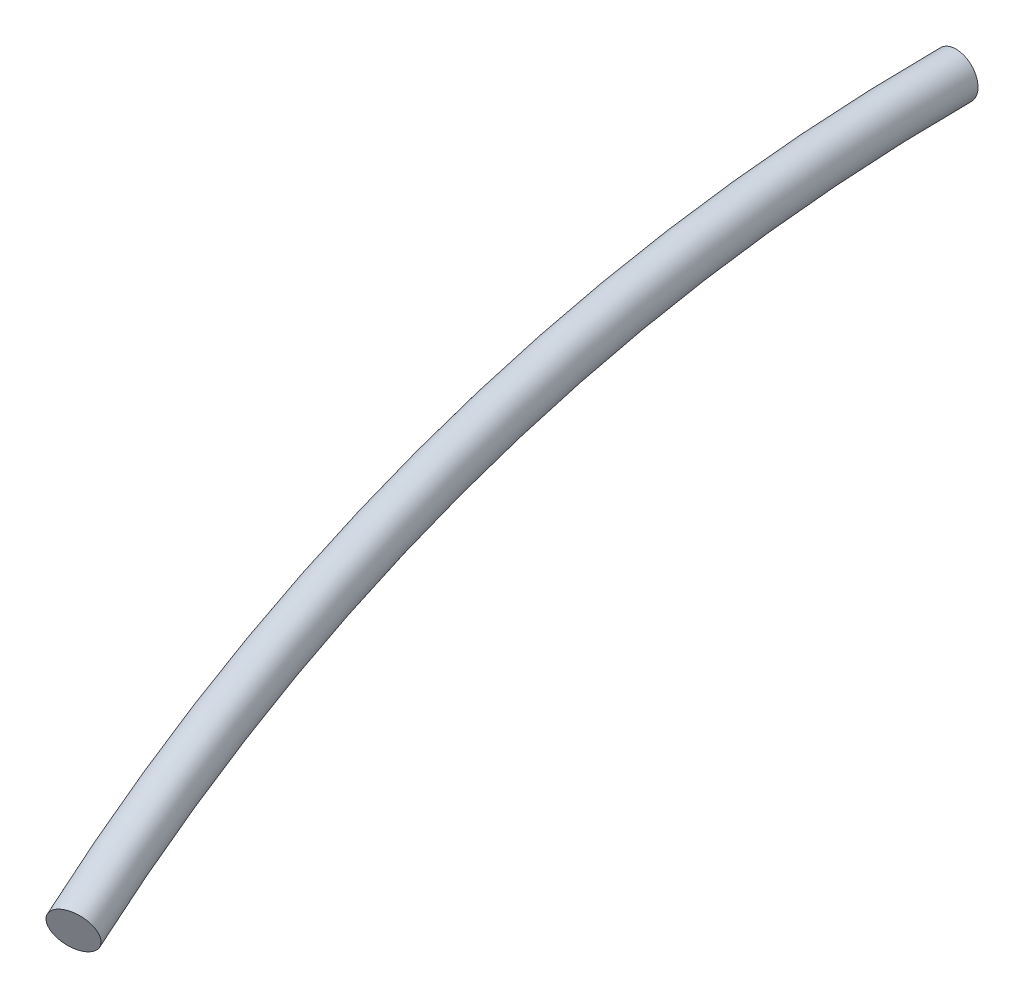
from build123d import *

# Parameters (mm, degrees)
SKETCH1_R = 50.8


with BuildPart() as part:
    # Sweep1: sweep along a path in Sketch2
    with BuildLine(Plane(origin=(-10809.997060034, -9711.929518377, 0), x_dir=(-0.6172701058211517, 0.6870610023010654, -0.38330770351846527), z_dir=(0.7438778705374912, 0.6683155794417841, -1.7208456881689926e-15))) as sweep1_path:
        ThreePointArc((-6409.023621687, -2659.780271502), (-6987.846184652, -1589.154447528), (-7772.033955362, -658.388765615))
    # Sketch1 → Sweep1 (sweep)
    with BuildSketch(Plane.XY):
        with Locations((-6172.541102276, -14873.713814129)):
            Circle(SKETCH1_R)
    sweep(path=sweep1_path.line)


solid = part.part
